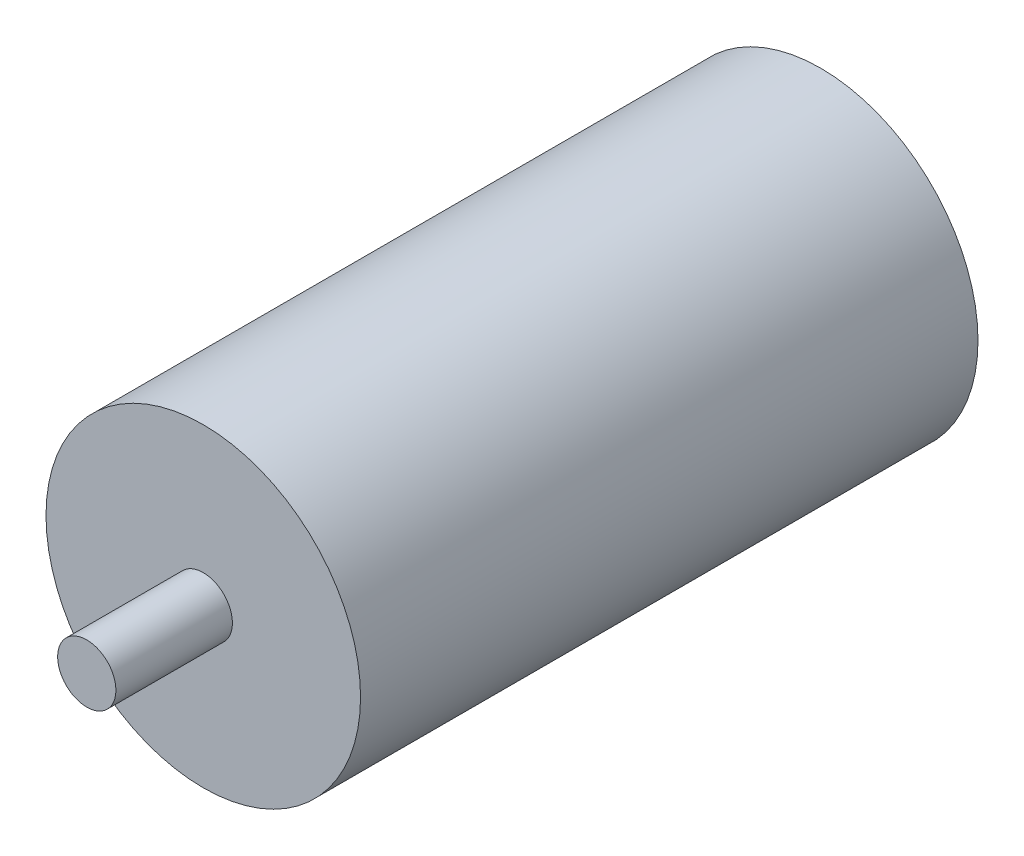
from build123d import *

# Parameters (mm, degrees)
SKETCH1_R           = 67.5
BOSS_EXTRUDE1_DEPTH = 265
SKETCH2_R           = 12.5
BOSS_EXTRUDE2_DEPTH = 50


with BuildPart() as part:
    # Sketch1 → Boss-Extrude1 (new body)
    with BuildSketch(Plane.XY):
        Circle(SKETCH1_R)
    extrude(amount=BOSS_EXTRUDE1_DEPTH)

    # Sketch2 → Boss-Extrude2 (add)
    with BuildSketch(Plane.XY.offset(265)):
        Circle(SKETCH2_R)
    extrude(amount=BOSS_EXTRUDE2_DEPTH)


solid = part.part
